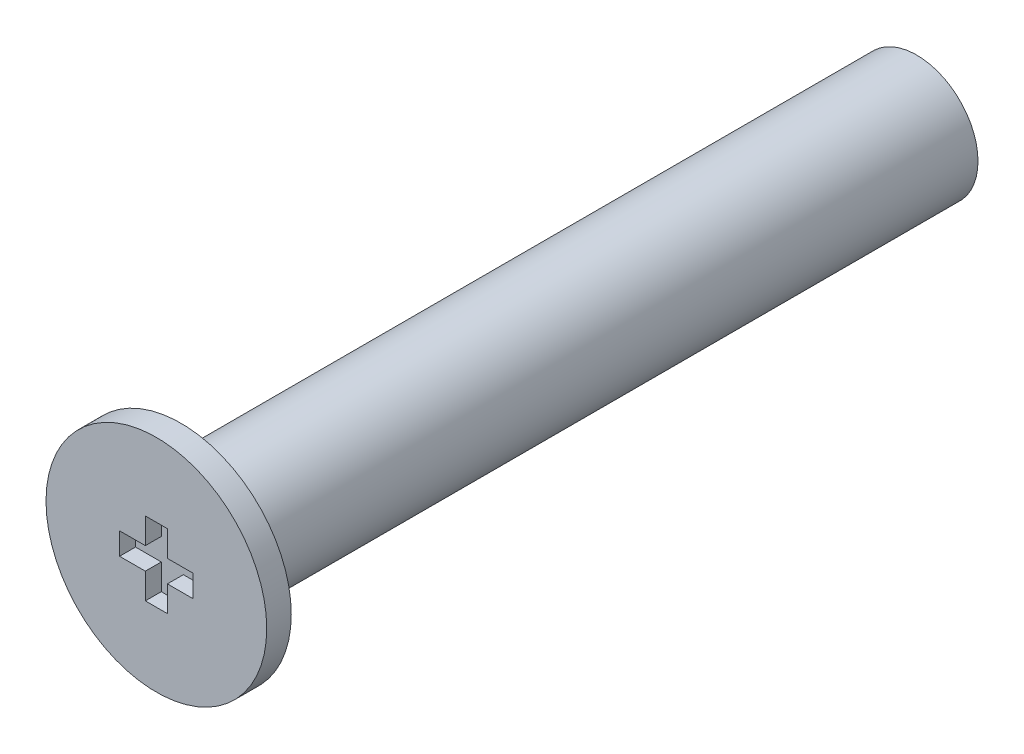
from build123d import *

# Parameters (mm, degrees)
SKETCH_1_R        = 2.5
EXTRUDE_198_DEPTH = 30
SKETCH_6_W        = 4.5
SKETCH_6_H        = 1
PH2_START         = 1.01
PH2_DEPTH         = 0.66


with BuildPart() as part:
    # 草图1 → Extrude 198 (new body)
    with BuildSketch(Plane.XY):
        Circle(SKETCH_1_R)
    extrude(amount=-EXTRUDE_198_DEPTH)

    # 草图6 → Revolve 324 (revolve)
    with BuildSketch(Plane(origin=(0, 0, 0), x_dir=(1, 0, 0), z_dir=(0, 1, 0)), mode=Mode.PRIVATE) as revolve_324_sk:
        with Locations((2.25, -0.5)):
            Rectangle(SKETCH_6_W, SKETCH_6_H)
    revolve(revolve_324_sk.sketch.rotate(Axis((0, 0, -2), (0, 0, 1)), 180), axis=Axis((0, 0, -2), (0, 0, 1)))

    # 草图7 → 十字槽_PH2_简化 (cut)
    with BuildSketch(Plane.XY.offset(PH2_START)):
        Polygon((-0.45, -1.5), (0.45, -1.5), (0.45, -0.45), (1.5, -0.45), (1.5, 0.45), (0.45, 0.45), (0.45, 1.5), (-0.45, 1.5), (-0.45, 0.45), (-1.5, 0.45), (-1.5, -0.45), (-0.45, -0.45), align=None)
    extrude(amount=-PH2_DEPTH, mode=Mode.SUBTRACT)


solid = part.part
